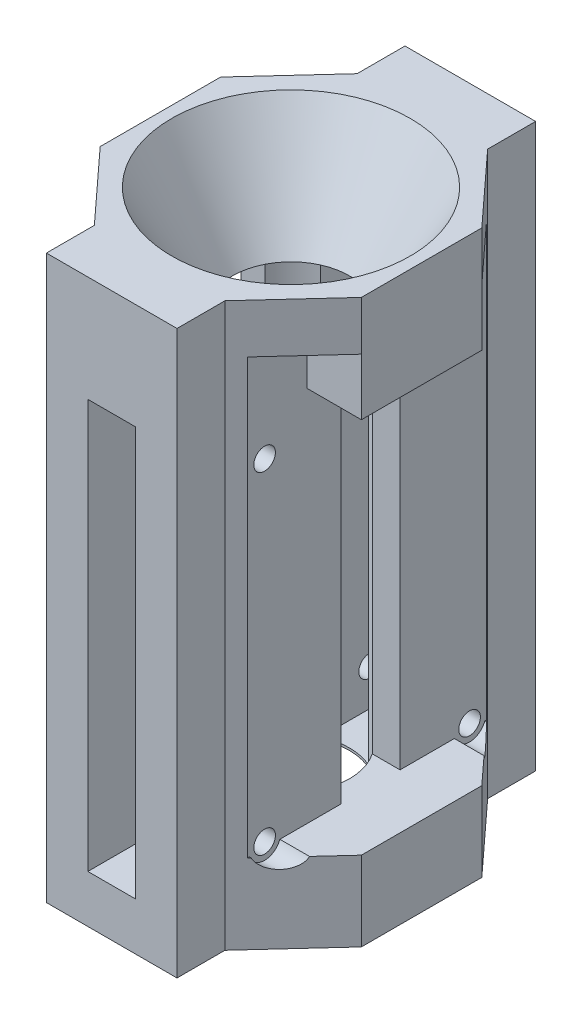
from build123d import *

# Parameters (mm, degrees)
SALIENTE_EXTRUIR1_DEPTH      = 77.5
SALIENTE_EXTRUIR1_DEPTH_BACK = 77.5
CROQUIS3_W                   = 82.87
CROQUIS3_H                   = 362
CROQUIS4_W                   = 230
CROQUIS4_H                   = 315.74
CROQUIS4_R                   = 110
SALIENTE_EXTRUIR2_DEPTH      = 495.3
CORTAR_EXTRUIR1_DEPTH        = 447.936166471
CORTAR_EXTRUIR1_DEPTH_BACK   = 447.936166471
CROQUIS5_W                   = 42
CROQUIS5_H                   = 360
CROQUIS6_W                   = 140.888518715
CROQUIS6_H                   = 52
CROQUIS6_W_2                 = 161.625356967
CORTAR_EXTRUIR2_DEPTH        = 332
CORTAR_EXTRUIR3_START        = -495.3
CORTAR_EXTRUIR3_DEPTH        = 495.3
CROQUIS12_R                  = 9.525
CORTAR_EXTRUIR9_DEPTH        = 230
CROQUIS15_R                  = 14.29
CORTAR_EXTRUIR10_DEPTH       = 48
CORTAR_EXTRUIR11_START       = -48
CROQUIS16_R                  = 14.29
CORTAR_EXTRUIR11_DEPTH       = 48
CROQUIS18_W                  = 231.274148036
CROQUIS18_H                  = 332
CORTAR_EXTRUIR12_DEPTH       = 48
CROQUIS19_W                  = 231.274148036
CROQUIS19_H                  = 332
CORTAR_EXTRUIR13_DEPTH       = 48
CROQUIS20_W                  = 52.279992223
CROQUIS20_H                  = 50
CORTAR_EXTRUIR14_DEPTH       = 48
CROQUIS21_W                  = 52.279992223
CROQUIS21_H                  = 50
CORTAR_EXTRUIR15_DEPTH       = 48


with BuildPart() as part:
    # Croquis1 → Revolución1 (revolve)
    with BuildSketch(Plane.XY, mode=Mode.PRIVATE) as revoluci_n1_sk:
        Polygon((-110, 93.3), (-105, 93.3), (-51.5, 0), (-51.5, -362), (-105, -402), (-110, -402), align=None)
    revolve(revoluci_n1_sk.sketch.rotate(Axis((0, 0, 0), (0, 1, 0)), 270), axis=Axis((0, 0, 0), (0, 1, 0)))

    # Croquis3 → Saliente-Extruir1 (add, two sides: drawn at the far end of the back side and taken through both)
    with BuildSketch(Plane(origin=(0, 0, 0), x_dir=(0, 0, -1), z_dir=(1, 0, 0)).offset(-SALIENTE_EXTRUIR1_DEPTH_BACK)):
        with Locations((116.435, -181)):
            Rectangle(CROQUIS3_W, CROQUIS3_H)
        with Locations((-116.435, -181)):
            Rectangle(CROQUIS3_W, CROQUIS3_H)
    extrude(amount=SALIENTE_EXTRUIR1_DEPTH + SALIENTE_EXTRUIR1_DEPTH_BACK)

    # Croquis4 → Saliente-Extruir2 (add)
    with BuildSketch(Plane(origin=(0, 93.3, 0), x_dir=(1, 0, 0), z_dir=(0, 1, 0))):
        Rectangle(CROQUIS4_W, CROQUIS4_H)
        Circle(CROQUIS4_R, mode=Mode.SUBTRACT)
    extrude(amount=-SALIENTE_EXTRUIR2_DEPTH)

    # Croquis5 → Cortar-Extruir1 (cut, two sides: drawn at the far end of the back side and taken through both)
    with BuildSketch(Plane.XY.offset(-CORTAR_EXTRUIR1_DEPTH_BACK)):
        with Locations((0, -180)):
            Rectangle(CROQUIS5_W, CROQUIS5_H)
    extrude(amount=CORTAR_EXTRUIR1_DEPTH + CORTAR_EXTRUIR1_DEPTH_BACK, mode=Mode.SUBTRACT)

    # Croquis6 → Cortar-Extruir2 (cut)
    with BuildSketch(Plane(origin=(0, 0, 0), x_dir=(1, 0, 0), z_dir=(0, 1, 0))):
        with Locations((-100.594259358, -3)):
            Rectangle(CROQUIS6_W, CROQUIS6_H)
        with Locations((110.962678484, 3)):
            Rectangle(CROQUIS6_W_2, CROQUIS6_H)
    extrude(amount=-CORTAR_EXTRUIR2_DEPTH, mode=Mode.SUBTRACT)

    # Croquis7 → Cortar-Extruir3 (cut)
    with BuildSketch(Plane(origin=(0, 93.3, 0), x_dir=(1, 0, 0), z_dir=(0, 1, 0)).offset(CORTAR_EXTRUIR3_START)):
        Polygon((-115, 157.87), (-57.5, 157.87), (-57.5, 115.637074018), (-115, 53.01), align=None)
        Polygon((57.5, 115.637074018), (57.5, 157.87), (115, 157.87), (115, 53.01), align=None)
        Polygon((115, -157.87), (57.5, -157.87), (57.5, -115.637074018), (115, -53.01), align=None)
        Polygon((-57.5, -115.637074018), (-57.5, -157.87), (-115, -157.87), (-115, -53.01), align=None)
    extrude(amount=CORTAR_EXTRUIR3_DEPTH, mode=Mode.SUBTRACT)

    # Croquis12 → Cortar-Extruir9 (cut)
    with BuildSketch(Plane.ZY.offset(115)):
        with Locations(Location((-90.237074018, -327.07, 0), (0, 0, 90))):
            Circle(CROQUIS12_R)
        with Locations(Location((-90.237074018, -35.052, 0), (0, 0, 90))):
            Circle(CROQUIS12_R)
        with Locations(Location((90.237074018, -35.052, 0), (0, 0, 270))):
            Circle(CROQUIS12_R)
        with Locations(Location((90.237074018, -327.07, 0), (0, 0, 270))):
            Circle(CROQUIS12_R)
    extrude(amount=-CORTAR_EXTRUIR9_DEPTH, mode=Mode.SUBTRACT)

    # Croquis15 → Cortar-Extruir10 (cut)
    with BuildSketch(Plane.ZY.offset(115)):
        with Locations((-90.237074018, -35.052)):
            Circle(CROQUIS15_R)
        with Locations((90.237074018, -35.052)):
            Circle(CROQUIS15_R)
        with Locations((90.237074018, -327.07)):
            Circle(CROQUIS15_R)
        with Locations((-90.237074018, -327.07)):
            Circle(CROQUIS15_R)
    extrude(amount=-CORTAR_EXTRUIR10_DEPTH, mode=Mode.SUBTRACT)

    # Croquis16 → Cortar-Extruir11 (cut)
    with BuildSketch(Plane(origin=(115, 0, 0), x_dir=(0, 0, -1), z_dir=(1, 0, 0)).offset(CORTAR_EXTRUIR11_START)):
        with Locations(Location((-90.237074018, -35.052, 0), (0, 0, 180))):
            Circle(CROQUIS16_R)
        with Locations(Location((90.237074018, -35.052, 0), (0, 0, 180))):
            Circle(CROQUIS16_R)
        with Locations(Location((90.237074018, -327.07, 0), (0, 0, 180))):
            Circle(CROQUIS16_R)
        with Locations(Location((-90.237074018, -327.07, 0), (0, 0, 180))):
            Circle(CROQUIS16_R)
    extrude(amount=CORTAR_EXTRUIR11_DEPTH, mode=Mode.SUBTRACT)

    # Croquis18 → Cortar-Extruir12 (cut)
    with BuildSketch(Plane(origin=(115, 0, 0), x_dir=(0, 0, -1), z_dir=(1, 0, 0))):
        with Locations((0, -166)):
            Rectangle(CROQUIS18_W, CROQUIS18_H)
    extrude(amount=-CORTAR_EXTRUIR12_DEPTH, mode=Mode.SUBTRACT)

    # Croquis19 → Cortar-Extruir13 (cut)
    with BuildSketch(Plane.ZY.offset(115)):
        with Locations((0, -166)):
            Rectangle(CROQUIS19_W, CROQUIS19_H)
    extrude(amount=-CORTAR_EXTRUIR13_DEPTH, mode=Mode.SUBTRACT)

    # Croquis20 → Cortar-Extruir14 (cut)
    with BuildSketch(Plane.ZY.offset(115)):
        with Locations((-79.149996112, 25)):
            Rectangle(CROQUIS20_W, CROQUIS20_H)
        with Locations((79.149996112, 25)):
            Rectangle(CROQUIS20_W, CROQUIS20_H)
    extrude(amount=-CORTAR_EXTRUIR14_DEPTH, mode=Mode.SUBTRACT)

    # Croquis21 → Cortar-Extruir15 (cut)
    with BuildSketch(Plane(origin=(115, 0, 0), x_dir=(0, 0, -1), z_dir=(1, 0, 0))):
        with Locations((79.149996112, 25)):
            Rectangle(CROQUIS21_W, CROQUIS21_H)
        with Locations((-79.149996112, 25)):
            Rectangle(CROQUIS21_W, CROQUIS21_H)
    extrude(amount=-CORTAR_EXTRUIR15_DEPTH, mode=Mode.SUBTRACT)


solid = part.part
